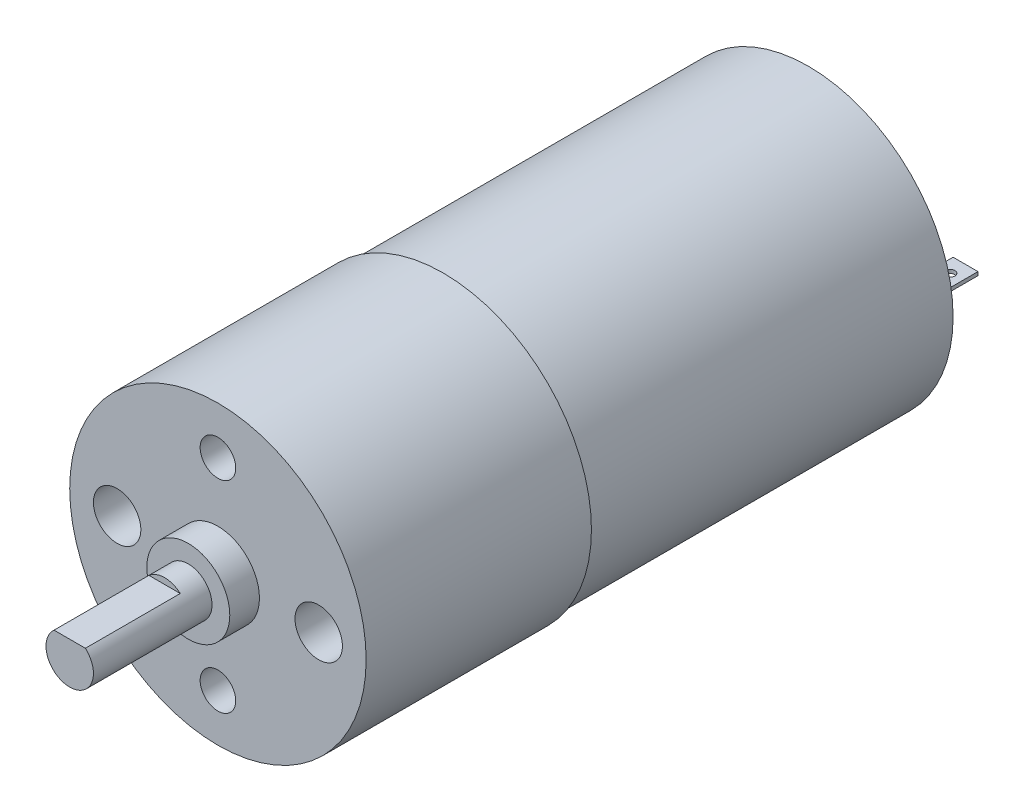
from build123d import *
from build123d.topology import SkipClean

# Parameters (mm, degrees)
SKETCH1_R           = 12.5
SKETCH1_R_2         = 3.2
SKETCH1_R_3         = 1.5
BOSS_EXTRUDE1_DEPTH = 19
BOSS_EXTRUDE2_START = 30.8
SKETCH3_R           = 12.2
SKETCH3_R_2         = 3.2
BOSS_EXTRUDE2_DEPTH = 30.8
SKETCH4_W           = 2.1
SKETCH4_H           = 0.3
BOSS_EXTRUDE3_DEPTH = 4.2
SKETCH6_R           = 3.5
SKETCH6_R_2         = 2
BOSS_EXTRUDE4_DEPTH = 2.5
SKETCH7_R           = 2
BOSS_EXTRUDE5_DEPTH = 12.5
CUT_EXTRUDE1_DEPTH  = 8
SKETCH10_R          = 2
CUT_EXTRUDE2_DEPTH  = 6
SKETCH11_R          = 3.2
BOSS_EXTRUDE6_DEPTH = 1
SKETCH12_R          = 3.2
BOSS_EXTRUDE7_DEPTH = 0.5
BOSS_EXTRUDE7_TAPER = 23
SKETCH13_R          = 0.4
CUT_EXTRUDE3_DEPTH  = 0.5
SKETCH14_R          = 0.4
CUT_EXTRUDE4_DEPTH  = 0.5


with BuildPart() as part:
    # Sketch1 → Boss-Extrude1 (new body)
    with BuildSketch(Plane.XY):
        Circle(SKETCH1_R)
        Circle(SKETCH1_R_2, mode=Mode.SUBTRACT)
        with Locations((0, 8.5)):
            Circle(SKETCH1_R_3, mode=Mode.SUBTRACT)
        with Locations(Location((0, -8.5, 0), (0, 0, 180))):
            Circle(SKETCH1_R_3, mode=Mode.SUBTRACT)
    extrude(amount=BOSS_EXTRUDE1_DEPTH)

    # Sketch3 → Boss-Extrude2 (add)
    with SkipClean():  # the faces are left unmerged after this step: merging them gives an invalid solid
        with BuildSketch(Plane(origin=(0, 0, 0), x_dir=(-1, 0, 0), z_dir=(0, 0, -1)).offset(BOSS_EXTRUDE2_START)):
            with Locations(Location((0, 0, 0), (0, 0, 180))):
                Circle(SKETCH3_R)
            Circle(SKETCH3_R_2, mode=Mode.SUBTRACT)
        extrude(amount=-BOSS_EXTRUDE2_DEPTH)

    # Sketch4 → Boss-Extrude3 (add)
    with SkipClean():  # the faces are left unmerged after this step: merging them gives an invalid solid
        with BuildSketch(Plane(origin=(0, 0, -30.8), x_dir=(-1, 0, 0), z_dir=(0, 0, -1))):
            with Locations((9.05, 0)):
                Rectangle(SKETCH4_W, SKETCH4_H)
            with Locations((-9.05, 0)):
                Rectangle(SKETCH4_W, SKETCH4_H)
        extrude(amount=BOSS_EXTRUDE3_DEPTH)

    # Sketch6 → Boss-Extrude4 (add)
    with BuildSketch(Plane.XY.offset(19)):
        Circle(SKETCH6_R)
        Circle(SKETCH6_R_2, mode=Mode.SUBTRACT)
    extrude(amount=BOSS_EXTRUDE4_DEPTH)

    # Sketch7 → Boss-Extrude5 (add)
    with BuildSketch(Plane.XY.offset(19)):
        Circle(SKETCH7_R)
    extrude(amount=BOSS_EXTRUDE5_DEPTH)

    # Sketch9 → Cut-Extrude1 (cut)
    with BuildSketch(Plane.XY.offset(31.5)):
        Polygon((-50.671161076, 1.5), (-1.322875656, 1.5), (1.322875656, 1.5), (50.671161076, 1.5), (50.671161076, 100.196570842), (-50.671161076, 100.196570842), align=None)
    extrude(amount=-CUT_EXTRUDE1_DEPTH, mode=Mode.SUBTRACT)

    # Sketch10 → Cut-Extrude2 (cut)
    with BuildSketch(Plane.XY.offset(19)):
        with Locations((-8.5, 0)):
            Circle(SKETCH10_R)
        with Locations(Location((8.5, 0, 0), (0, 0, 180))):
            Circle(SKETCH10_R)
    extrude(amount=-CUT_EXTRUDE2_DEPTH, mode=Mode.SUBTRACT)

    # Sketch13 → Cut-Extrude3 (cut)
    with BuildSketch(Plane(origin=(0, 0.15, 0), x_dir=(1, 0, 0), z_dir=(0, 1, 0))):
        with Locations(Location((9.05, 33.7, 0), (0, 0, 270))):
            Circle(SKETCH13_R)
    extrude(amount=-CUT_EXTRUDE3_DEPTH, mode=Mode.SUBTRACT)

    # Sketch14 → Cut-Extrude4 (cut)
    with BuildSketch(Plane(origin=(0, 0.15, 0), x_dir=(1, 0, 0), z_dir=(0, 1, 0))):
        with Locations(Location((-9.05, 33.7, 0), (0, 0, 270))):
            Circle(SKETCH14_R)
    extrude(amount=-CUT_EXTRUDE4_DEPTH, mode=Mode.SUBTRACT)


with BuildPart() as body_2:
    # Sketch11 → Boss-Extrude6 (new body)
    with BuildSketch(Plane(origin=(0, 0, -30.8), x_dir=(-1, 0, 0), z_dir=(0, 0, -1))):
        Circle(SKETCH11_R)
    extrude(amount=BOSS_EXTRUDE6_DEPTH)

    # Sketch12 → Boss-Extrude7 (add)
    with BuildSketch(Plane(origin=(0, 0, -31.8), x_dir=(-1, 0, 0), z_dir=(0, 0, -1))):
        Circle(SKETCH12_R)
    extrude(amount=BOSS_EXTRUDE7_DEPTH, taper=BOSS_EXTRUDE7_TAPER)


solid = Compound([part.part, body_2.part])
